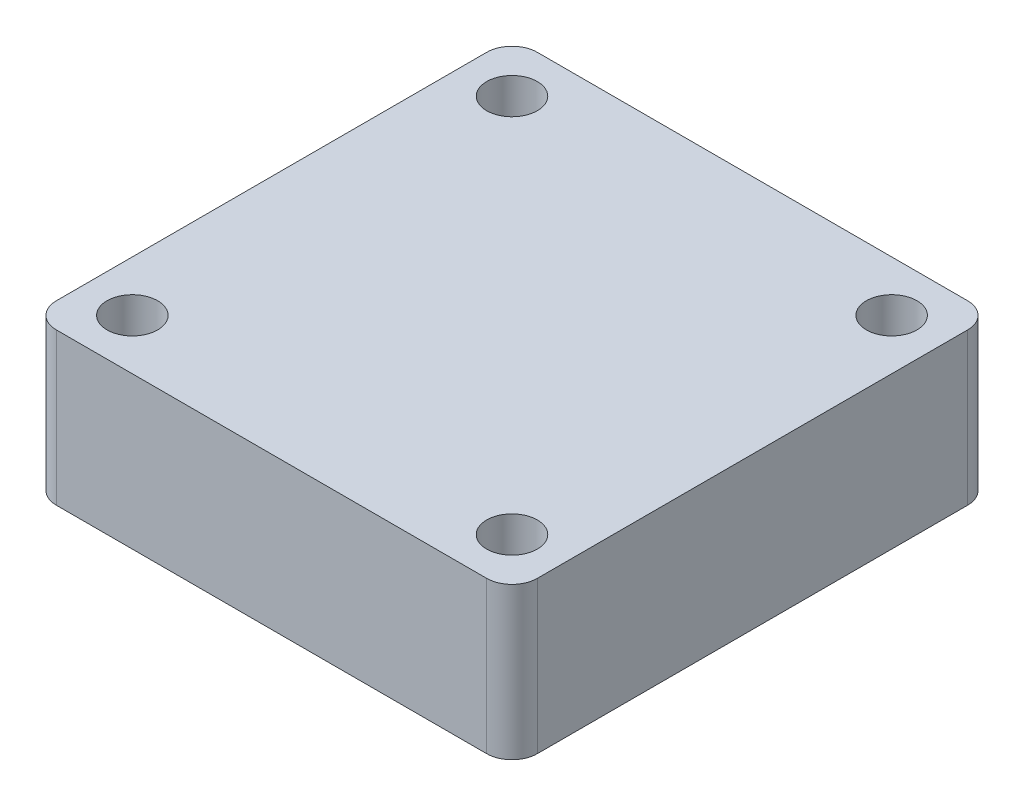
from build123d import *

# Parameters (mm, degrees)
SKETCH_1_W      = 19
SKETCH_1_H      = 19
SKETCH_1_R      = 1
EXTRUDE_1_DEPTH = 6
FILLET_1_R      = 1


with BuildPart() as part:
    # Эскиз1 → Бобышка-Вытянуть1 (new body)
    with BuildSketch(Plane(origin=(0, 0, 0), x_dir=(1, 0, 0), z_dir=(0, 1, 0))):
        with Locations((9.5, 9.5)):
            Rectangle(SKETCH_1_W, SKETCH_1_H)
        with Locations(Location((2, 17, 0), (0, 0, 270))):
            Circle(SKETCH_1_R, mode=Mode.SUBTRACT)
        with Locations(Location((17, 17, 0), (0, 0, 270))):
            Circle(SKETCH_1_R, mode=Mode.SUBTRACT)
        with Locations(Location((17, 2, 0), (0, 0, 270))):
            Circle(SKETCH_1_R, mode=Mode.SUBTRACT)
        with Locations(Location((2, 2, 0), (0, 0, 270))):
            Circle(SKETCH_1_R, mode=Mode.SUBTRACT)
    extrude(amount=EXTRUDE_1_DEPTH)

    # Скругление1
    fillet_1_edges = [part.edges().sort_by_distance(p)[0] for p in [
        (0, 3, -19),
        (19, 3, -19),
        (19, 3, 0),
        (0, 3, 0),
    ]]
    fillet(fillet_1_edges, radius=FILLET_1_R)


solid = part.part
